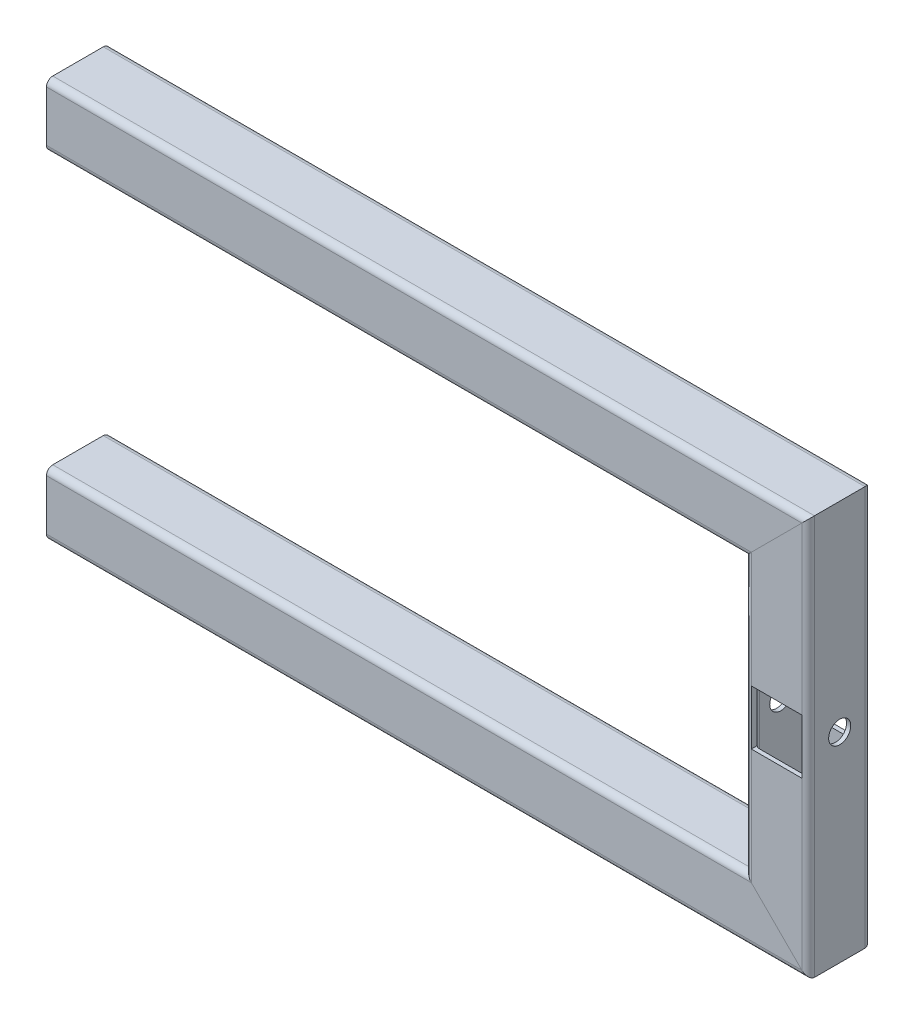
from build123d import *

# Parameters (mm, degrees)
ESQUISSE3_R             = 5.25
ENL_V_MAT_EXTRU_1_DEPTH = 46
ESQUISSE4_W             = 24
ESQUISSE4_H             = 26
ENL_V_MAT_EXTRU_2_DEPTH = 46


with BuildPart() as part:
    # Balayage1: sweep along a path in Esquisse1
    with BuildLine(Plane.XY) as balayage1_path:
        Line((0, 0), (347, 0))
        Line((347, 0), (347, 160))
        Line((347, 160), (0, 160))
    # Esquisse2 → Balayage1 (sweep)
    with BuildSketch(Plane(origin=(0, 0, 0), x_dir=(0, 0, -1), z_dir=(1, 0, 0))):
        with BuildLine():
            Line((-12, -15), (12, -15))
            ThreePointArc((12, -15), (14.121320344, -14.121320344), (15, -12))
            Line((15, -12), (15, 12))
            ThreePointArc((15, 12), (14.121320344, 14.121320344), (12, 15))
            Line((12, 15), (-12, 15))
            ThreePointArc((-12, 15), (-14.121320344, 14.121320344), (-15, 12))
            Line((-15, 12), (-15, -12))
            ThreePointArc((-15, -12), (-14.121320344, -14.121320344), (-12, -15))
        make_face()
        with BuildLine():
            Line((-10, -13), (10, -13))
            ThreePointArc((10, -13), (12.121320344, -12.121320344), (13, -10))
            Line((13, -10), (13, 10))
            ThreePointArc((13, 10), (12.121320344, 12.121320344), (10, 13))
            Line((10, 13), (-10, 13))
            ThreePointArc((-10, 13), (-12.121320344, 12.121320344), (-13, 10))
            Line((-13, 10), (-13, -10))
            ThreePointArc((-13, -10), (-12.121320344, -12.121320344), (-10, -13))
        make_face(mode=Mode.SUBTRACT)
    sweep(path=balayage1_path.line, transition=Transition.RIGHT)

    # Esquisse3 → Enlèv. mat.-Extru.1 (cut)
    with BuildSketch(Plane(origin=(362, 0, 0), x_dir=(0, 0, -1), z_dir=(1, 0, 0))):
        with Locations(Location((0, 80, 0), (0, 0, 90))):
            Circle(ESQUISSE3_R)
    extrude(amount=-ENL_V_MAT_EXTRU_1_DEPTH, mode=Mode.SUBTRACT)

    # Esquisse4 → Enlèv. mat.-Extru.2 (cut)
    with BuildSketch(Plane.XY.offset(15)):
        with Locations((347, 80)):
            Rectangle(ESQUISSE4_W, ESQUISSE4_H)
    extrude(amount=-ENL_V_MAT_EXTRU_2_DEPTH, mode=Mode.SUBTRACT)


solid = part.part
